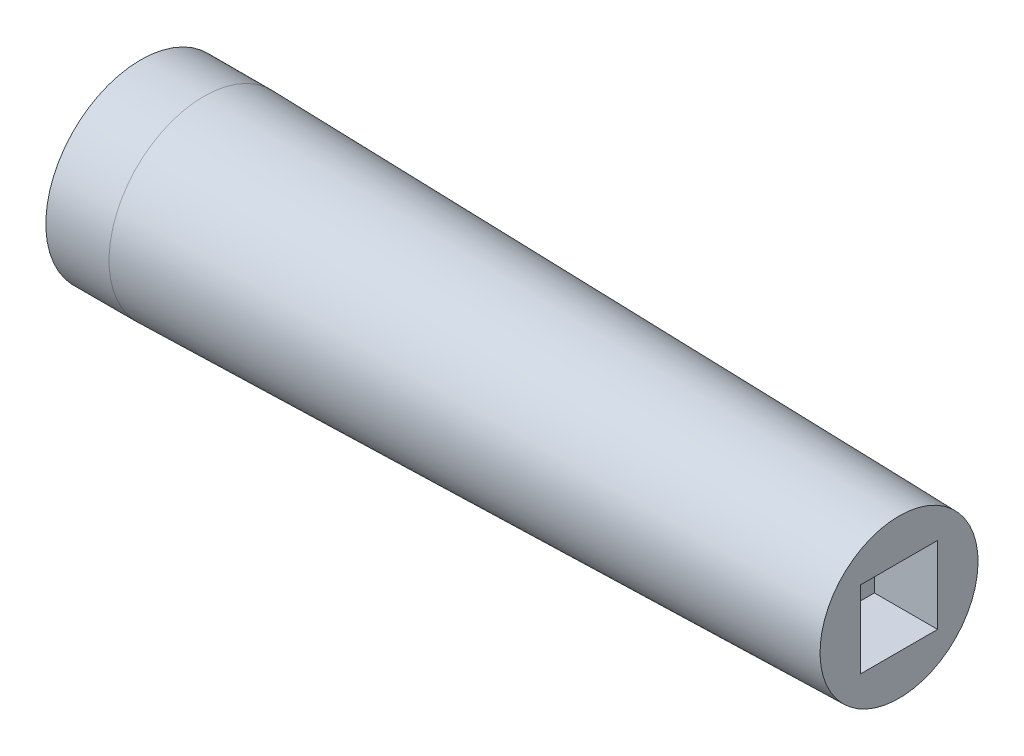
from build123d import *

# Parameters (mm, degrees)
SKETCH2_W          = 15.494
SKETCH2_H          = 15.494
CUT_EXTRUDE1_DEPTH = 12.7


with BuildPart() as part:
    # Sketch1 → Revolve1 (revolve)
    with BuildSketch(Plane.XY):
        Polygon((0, 15.875), (0, 0), (-152.4, 0), (-152.4, 19.05), (-139.7, 19.05), align=None)
    revolve(axis=Axis((0, 0, 0), (-1, 0, 0)))

    # Sketch2 → Cut-Extrude1 (cut)
    with BuildSketch(Plane(origin=(0, 0, 0), x_dir=(0, 0, -1), z_dir=(1, 0, 0))):
        Rectangle(SKETCH2_W, SKETCH2_H)
    extrude(amount=-CUT_EXTRUDE1_DEPTH, mode=Mode.SUBTRACT)


solid = part.part
